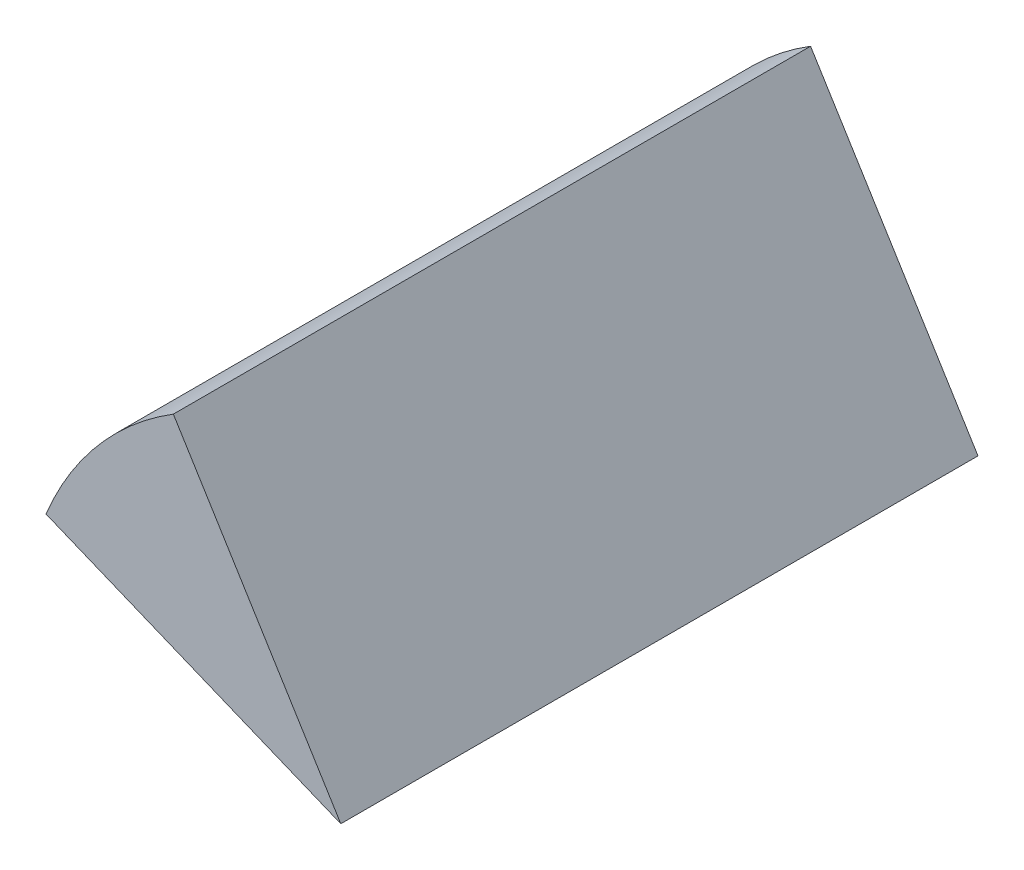
from build123d import *

# Parameters (mm, degrees)
SALIENTE_EXTRUIR1_DEPTH = 50
CROQUIS2_R              = 5
CORTAR_EXTRUIR1_DEPTH   = 10


with BuildPart() as part:
    # Croquis1 → Saliente-Extruir1 (new body)
    with BuildSketch(Plane.XY):
        with BuildLine():
            Line((0, 0), (-13.137574792, 21.269793807))
            ThreePointArc((-13.137574792, 21.269793807), (-19.067303867, 16.169042125), (-23.130592391, 9.485551943))
            Line((-23.130592391, 9.485551943), (0, 0))
        make_face()
    extrude(amount=SALIENTE_EXTRUIR1_DEPTH)

    # Croquis2 → Cortar-Extruir1 (cut)
    with BuildSketch(Plane(origin=(0, 0, 0), x_dir=(-1, 0, 0), z_dir=(0, 0, -1))):
        with Locations((14.38102057, 12.172217683)):
            Circle(CROQUIS2_R)
    extrude(amount=-CORTAR_EXTRUIR1_DEPTH, mode=Mode.SUBTRACT)


solid = part.part
